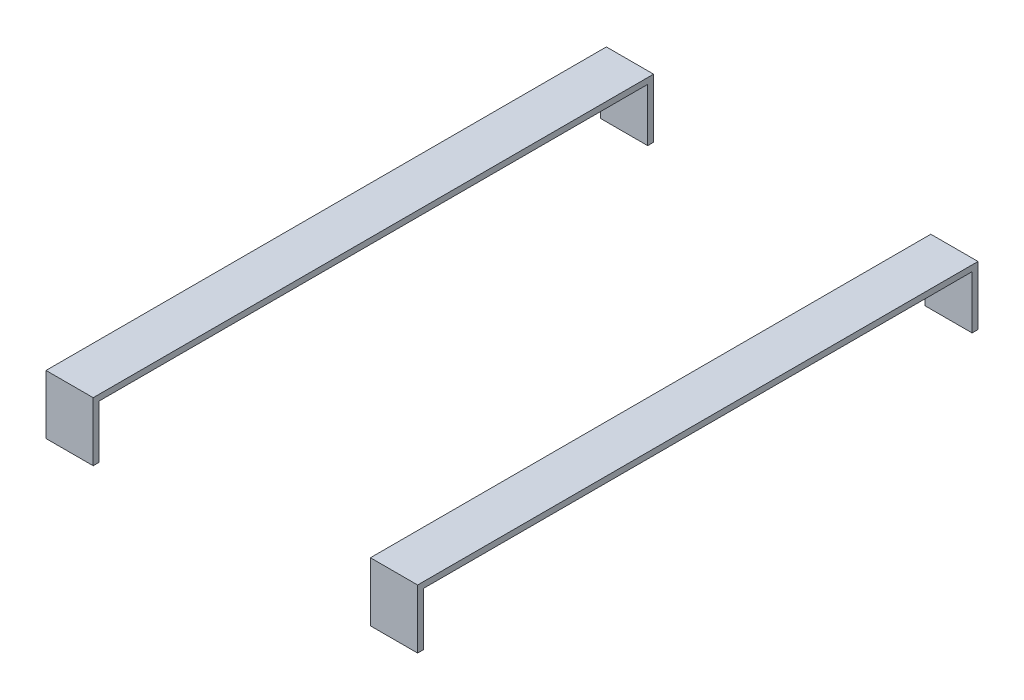
from build123d import *

# Parameters (mm, degrees)
CROQUIS1_W                = 80
CROQUIS1_H                = 10
SALIENTE_EXTRUIR1_DEPTH   = 100
SALIENTE_EXTRUIR1_2_DEPTH = 100
SALIENTE_EXTRUIR1_3_DEPTH = 100
SALIENTE_EXTRUIR1_4_DEPTH = 100
CROQUIS2_W                = 80
CROQUIS2_H                = 10
SALIENTE_EXTRUIR2_DEPTH   = 930


with BuildPart() as part:
    # Croquis1 → Saliente-Extruir1 (new body)
    with BuildSketch(Plane(origin=(0, 0, 0), x_dir=(1, 0, 0), z_dir=(0, 1, 0))):
        with Locations((-40, -5)):
            Rectangle(CROQUIS1_W, CROQUIS1_H)
    extrude(amount=SALIENTE_EXTRUIR1_DEPTH)



with BuildPart() as body_2:
    # Croquis1 → Saliente-Extruir1 2 (new body)
    with BuildSketch(Plane(origin=(0, 0, 0), x_dir=(1, 0, 0), z_dir=(0, 1, 0))):
        with Locations((510, -5)):
            Rectangle(CROQUIS1_W, CROQUIS1_H)
    extrude(amount=SALIENTE_EXTRUIR1_2_DEPTH)


with BuildPart() as body_3:
    # Croquis1 → Saliente-Extruir1 3 (new body)
    with BuildSketch(Plane(origin=(0, 0, 0), x_dir=(1, 0, 0), z_dir=(0, 1, 0))):
        with Locations((510, -945)):
            Rectangle(CROQUIS1_W, CROQUIS1_H)
    extrude(amount=SALIENTE_EXTRUIR1_3_DEPTH)


with BuildPart() as body_4:
    # Croquis1 → Saliente-Extruir1 4 (new body)
    with BuildSketch(Plane(origin=(0, 0, 0), x_dir=(1, 0, 0), z_dir=(0, 1, 0))):
        with Locations((-40, -945)):
            Rectangle(CROQUIS1_W, CROQUIS1_H)
    extrude(amount=SALIENTE_EXTRUIR1_4_DEPTH)


with BuildPart() as part_1:
    add(part.part)

    add(body_2.part)  # Saliente-Extruir2 merges body 2

    add(body_3.part)  # Saliente-Extruir2 merges body 3

    add(body_4.part)  # Saliente-Extruir2 merges body 4
    # Croquis2 → Saliente-Extruir2 (add)
    with BuildSketch(Plane.XY.offset(10)):
        with Locations((-40, 95)):
            Rectangle(CROQUIS2_W, CROQUIS2_H)
        with Locations((510, 95)):
            Rectangle(CROQUIS2_W, CROQUIS2_H)
    extrude(amount=SALIENTE_EXTRUIR2_DEPTH)


solid = part_1.part
